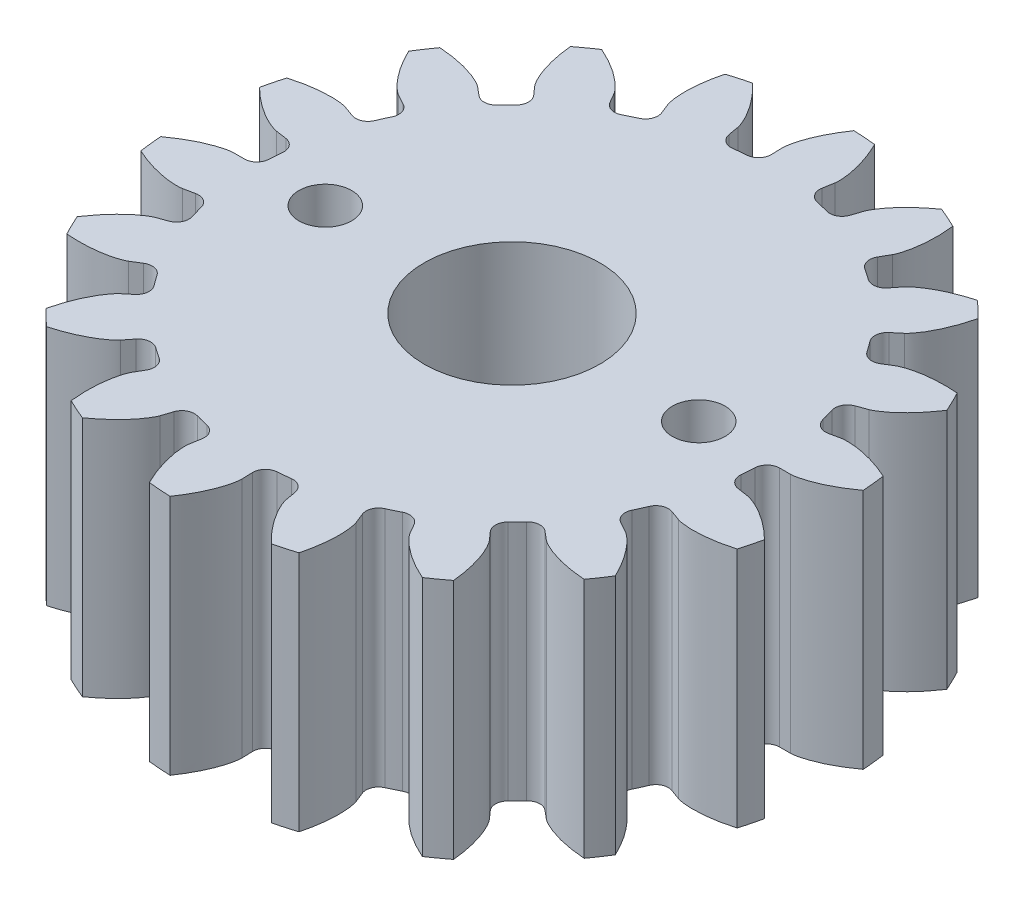
from build123d import *

# Parameters (mm, degrees)
ESQUISSE1_R                        = 15
BOSS_EXTRU_1_DEPTH                 = 11
ENL_V_MAT_EXTRU_1_DEPTH            = 24.895606291
CONG_1_R                           = 0.57
R_P_TITION_CIRCULAIRE1_COUNT       = 18
CONG_1_OF_R_P_TITION_CIRCULAIRE1_R = 0.57
ESQUISSE6_R                        = 4
ESQUISSE6_R_2                      = 1.2
ENL_V_MAT_EXTRU_2_DEPTH            = 24.866903692


with BuildPart() as part:
    # Esquisse1 → Boss.-Extru.1 (new body)
    with BuildSketch(Plane(origin=(0, 0, 0), x_dir=(1, 0, 0), z_dir=(0, 1, 0))):
        with Locations(Location((0, 0, 0), (0, 0, 270))):
            Circle(ESQUISSE1_R)
    extrude(amount=BOSS_EXTRU_1_DEPTH)

    # Esquisse5 → Enlèv. mat.-Extru.1 (cut, symmetric)
    with BuildSketch(Plane(origin=(0, 0, 0), x_dir=(1, 0, 0), z_dir=(0, 1, 0))):
        with BuildLine():
            add(Edge.make_bspline(
                [(12.685850381, 0), (12.69522907, 0.00019847), (12.721513502, 0.001369319), (12.771095723, 0.006007086), (12.851667315, 0.017005792), (12.953705597, 0.036042512), (13.084625834, 0.066377448), (13.237381246, 0.10942845), (13.403418578, 0.164334622), (13.581780638, 0.232170805), (13.757479313, 0.30693713), (13.930450016, 0.388032644), (14.10054883, 0.474640612), (14.30376747, 0.58632283), (14.543374477, 0.72960052), (14.737348348, 0.85778235), (14.887738449, 0.9639137), (14.965016657, 1.020333489), (14.965245681, 1.020500713)],
                knots=[0, 0, 0, 0, 0, 0.005376748, 0.015083688, 0.02853182, 0.046610139, 0.064854849, 0.092110525, 0.119476175, 0.146842495, 0.174208853, 0.201574955, 0.228941013, 0.256307345, 0.307035032, 0.361767351, 0.361930045, 0.361930045, 0.361930045, 0.361930045, 0.361930045], degree=4))
            Line((12.685850381, 0), (11.625, 0))
            ThreePointArc((11.625, 0), (11.594577503, -0.840474584), (11.503469243, -1.676550143))
            Line((11.503469243, -1.676550143), (12.553229219, -1.829545313))
            add(Edge.make_bspline(
                [(12.553229219, -1.829545313), (12.562481238, -1.831094296), (12.588322027, -1.83604363), (12.636717046, -1.847783629), (12.714860096, -1.870287336), (12.813086179, -1.903840937), (12.938262857, -1.952739977), (13.083212536, -2.017371202), (13.239595538, -2.095649169), (13.406309664, -2.188499439), (13.569388787, -2.287823289), (13.728855665, -2.393016735), (13.884685677, -2.503250824), (14.069673077, -2.643073551), (14.286111753, -2.81940935), (14.459571469, -2.974225923), (14.593083156, -3.100936914), (14.661416652, -3.16791189), (14.661619164, -3.168110395)],
                knots=[0, 0, 0, 0, 0, 0.005376748, 0.015083688, 0.02853182, 0.046610139, 0.064854849, 0.092110525, 0.119476175, 0.146842495, 0.174208853, 0.201574955, 0.228941013, 0.256307345, 0.307035032, 0.361767351, 0.361930045, 0.361930045, 0.361930045, 0.361930045, 0.361930045], degree=4))
            ThreePointArc((14.661619164, -3.168110395), (14.915164891, -1.593065054), (15, 0))
            ThreePointArc((15, 0), (14.991308902, 0.51054617), (14.965245681, 1.020500713))
        make_face()
    enl_v_mat_extru_1 = extrude(amount=ENL_V_MAT_EXTRU_1_DEPTH, both=True, mode=Mode.SUBTRACT)

    # Congé1
    cong_1_edges = [part.edges().sort_by_distance(p)[0] for p in [
        (11.625, 5.5, 0),
        (11.503469243, 5.5, 1.676550143),
    ]]
    fillet(cong_1_edges, radius=CONG_1_R)

    # Répétition circulaire1: Enlèv. mat.-Extru.1 ×18 about axis
    r_p_tition_circulaire1_axis = Axis((0, 11, 0), (0, 1, 0))
    for i in range(1, R_P_TITION_CIRCULAIRE1_COUNT):
        add(enl_v_mat_extru_1.rotate(r_p_tition_circulaire1_axis, i * 360 / R_P_TITION_CIRCULAIRE1_COUNT), mode=Mode.SUBTRACT)

    # Congé1 of Répétition circulaire1
    cong_1_of_r_p_tition_circulaire1_edges = [part.edges().sort_by_distance(p)[0] for p in [
        (10.923926717, 5.5, -3.975984166),
        (11.383139081, 5.5, -2.358976402),
        (8.905266651, 5.5, -7.472405963),
        (9.889834349, 5.5, -6.109975577),
        (5.8125, 5.5, -10.067545319),
        (7.203669636, 5.5, -9.124021525),
        (2.018660065, 5.5, -11.448390129),
        (3.64863605, 5.5, -11.03757582),
        (-2.018660065, 5.5, -11.448390129),
        (-0.346476892, 5.5, -11.619835574),
        (-5.8125, 5.5, -10.067545319),
        (-4.299799607, 5.5, -10.800571667),
        (-8.905266651, 5.5, -7.472405963),
        (-7.734503031, 5.5, -8.678599418),
        (-10.923926717, 5.5, -3.975984166),
        (-10.236311241, 5.5, -5.509859997),
        (-11.625, 5.5, 0),
        (-11.503469243, 5.5, -1.676550143),
        (-10.923926717, 5.5, 3.975984166),
        (-11.383139081, 5.5, 2.358976402),
        (-8.905266651, 5.5, 7.472405963),
        (-9.889834349, 5.5, 6.109975577),
        (-5.8125, 5.5, 10.067545319),
        (-7.203669636, 5.5, 9.124021525),
        (-2.018660065, 5.5, 11.448390129),
        (-3.64863605, 5.5, 11.03757582),
        (2.018660065, 5.5, 11.448390129),
        (0.346476892, 5.5, 11.619835574),
        (5.8125, 5.5, 10.067545319),
        (4.299799607, 5.5, 10.800571667),
        (8.905266651, 5.5, 7.472405963),
        (7.734503031, 5.5, 8.678599418),
        (10.923926717, 5.5, 3.975984166),
        (10.236311241, 5.5, 5.509859997),
    ]]
    fillet(cong_1_of_r_p_tition_circulaire1_edges, radius=CONG_1_OF_R_P_TITION_CIRCULAIRE1_R)

    # Esquisse6 → Enlèv. mat.-Extru.2 (cut, through all)
    with BuildSketch(Plane(origin=(0, 11, 0), x_dir=(1, 0, 0), z_dir=(0, 1, 0))):
        with Locations(Location((0, 0, 0), (0, 0, 270))):
            Circle(ESQUISSE6_R)
        with Locations(Location((-8.5, 0, 0), (0, 0, 270))):
            Circle(ESQUISSE6_R_2)
        with Locations(Location((8.5, 0, 0), (0, 0, 270))):
            Circle(ESQUISSE6_R_2)
    extrude(amount=-ENL_V_MAT_EXTRU_2_DEPTH, mode=Mode.SUBTRACT)


solid = part.part
